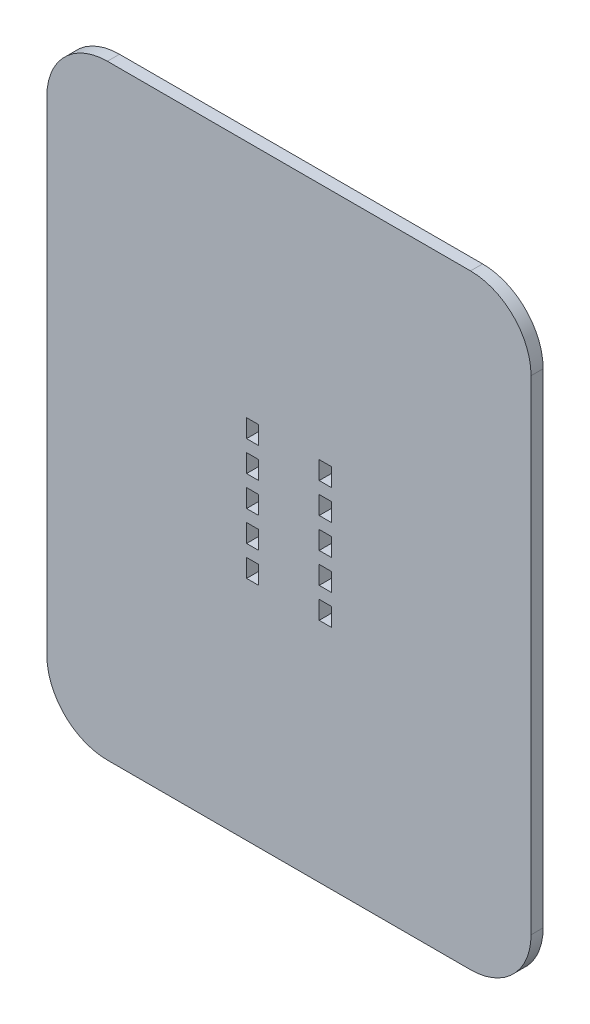
from build123d import *

# Parameters (mm, degrees)
SKETCH1_W           = 160
SKETCH1_H           = 200
BOSS_EXTRUDE1_DEPTH = 4
SKETCH2_W           = 4
SKETCH2_H           = 6
CUT_EXTRUDE1_DEPTH  = 4
FILLET1_R           = 20


with BuildPart() as part:
    # Sketch1 → Boss-Extrude1 (new body)
    with BuildSketch(Plane.XY):
        Rectangle(SKETCH1_W, SKETCH1_H)
    extrude(amount=BOSS_EXTRUDE1_DEPTH)

    # Sketch2 → Cut-Extrude1 (cut)
    with BuildSketch(Plane.XY.offset(4)):
        with Locations((12, 18)):
            Rectangle(SKETCH2_W, SKETCH2_H)
        with Locations((12, 8)):
            Rectangle(SKETCH2_W, SKETCH2_H)
        with Locations((12, -2)):
            Rectangle(SKETCH2_W, SKETCH2_H)
        with Locations((12, -12)):
            Rectangle(SKETCH2_W, SKETCH2_H)
        with Locations((12, -22)):
            Rectangle(SKETCH2_W, SKETCH2_H)
    cut_extrude1 = extrude(amount=-CUT_EXTRUDE1_DEPTH, mode=Mode.SUBTRACT)

    # Mirror1: Cut-Extrude1 across plane
    add(cut_extrude1.mirror(Plane(origin=(0, 0, 0), x_dir=(0, 0, 1), z_dir=(1, 0, 0))), mode=Mode.SUBTRACT)

    # Fillet1
    fillet1_edges = [part.edges().sort_by_distance(p)[0] for p in [
        (80, -100, 2),
        (-80, -100, 2),
        (-80, 100, 2),
        (80, 100, 2),
    ]]
    fillet(fillet1_edges, radius=FILLET1_R)


solid = part.part
